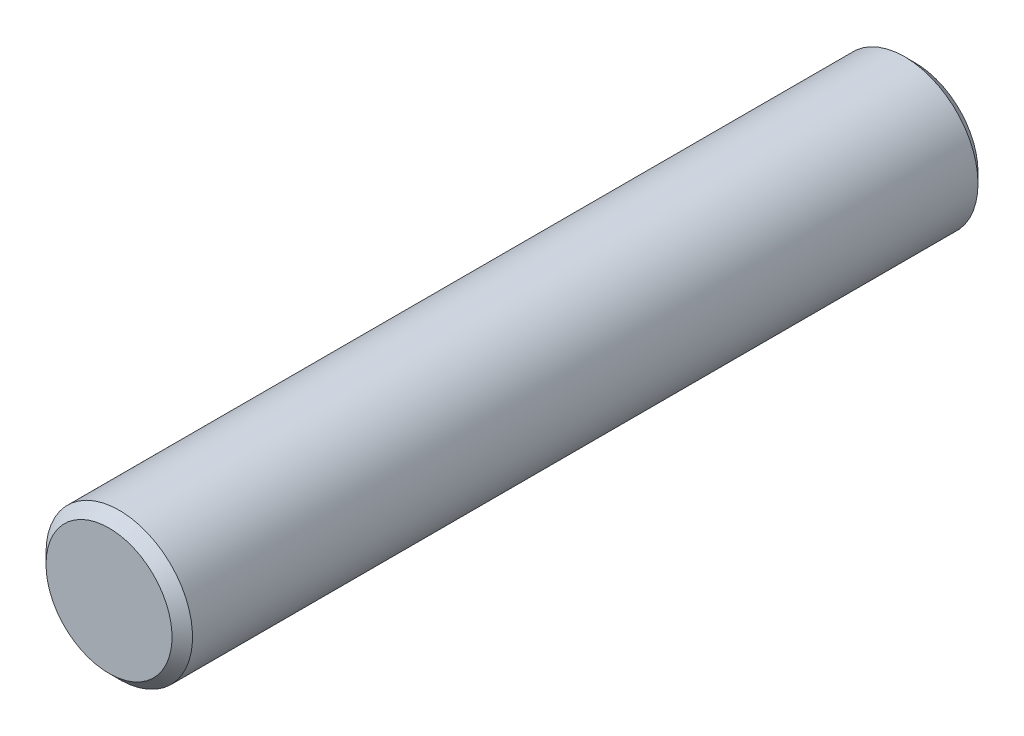
from build123d import *

# Parameters (mm, degrees)
SKICA1_R        = 5
VYSUNOUT1_DEPTH = 55
ZKOSIT1_SIZE    = 0.7


with BuildPart() as part:
    # Skica1 → Vysunout1 (new body)
    with BuildSketch(Plane.XY):
        Circle(SKICA1_R)
    extrude(amount=VYSUNOUT1_DEPTH)

    # Zkosit1
    zkosit1_edges = [part.edges().sort_by_distance(p)[0] for p in [
        (-5, 0, 0),
        (-5, 0, 55),
    ]]
    chamfer(zkosit1_edges, length=ZKOSIT1_SIZE)


solid = part.part
